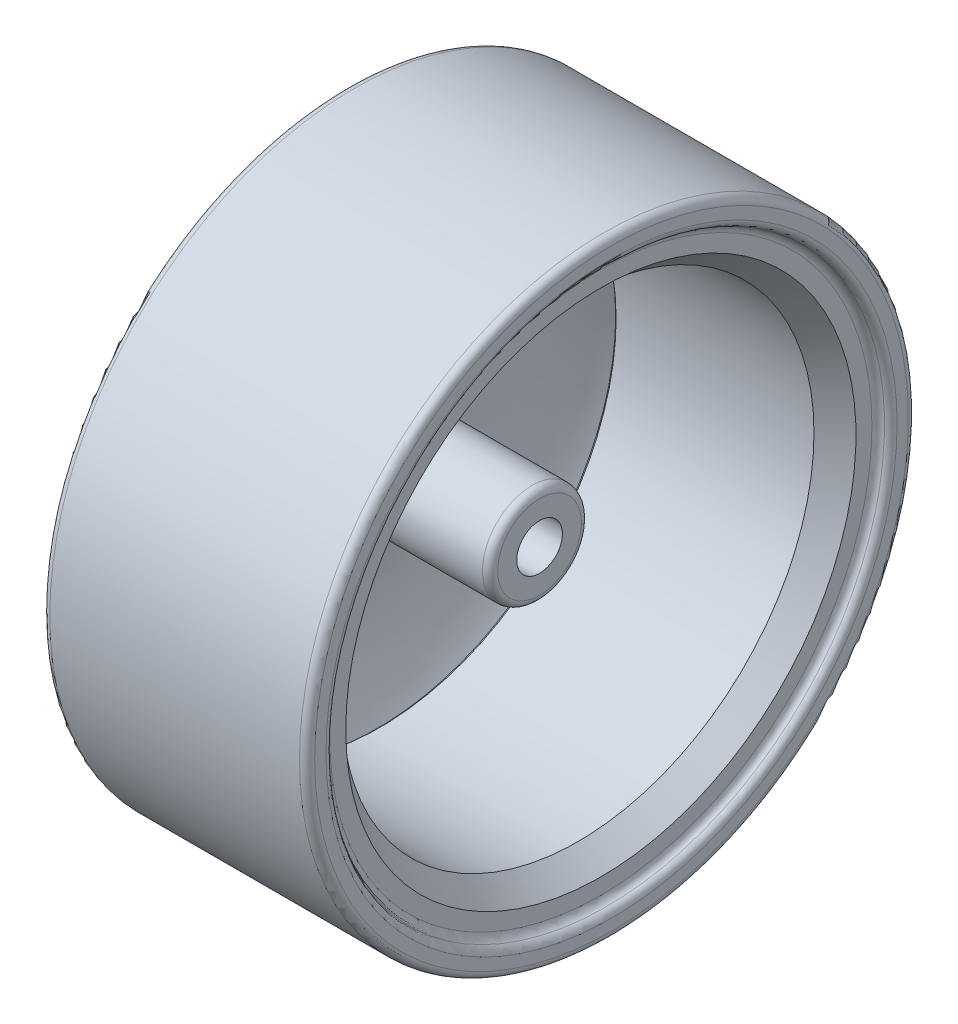
from build123d import *

# Parameters (mm, degrees)
FILLET2_R           = 0.5
FILLET3_R           = 0.5
SKETCH7_R           = 2.5
SKETCH7_R_2         = 1.5
BOSS_EXTRUDE1_DEPTH = 10
FILLET4_R           = 0.5


with BuildPart() as part:
    # Sketch1 → Revolve1 (revolve)
    with BuildSketch(Plane(origin=(0, 0, 0), x_dir=(1, 0, 0), z_dir=(0, 1, 0)), mode=Mode.PRIVATE) as revolve1_sk:
        Polygon((6.5, 15.5), (-6.5, 15.5), (-8, 16.758649447), (-8, 18.258649447), (-6.5, 18.258649447), (-5, 16.5), (5, 16.5), (6.5, 18.258649447), (8, 18.258649447), (8, 16.758649447), align=None)
    revolve(revolve1_sk.sketch.rotate(Axis((-5, 0, 0), (1, 0, 0)), 180), axis=Axis((-5, 0, 0), (1, 0, 0)))



with BuildPart() as body_2:
    # Sketch4 → Revolve2 (revolve)
    with BuildSketch(Plane(origin=(0, 0, 0), x_dir=(1, 0, 0), z_dir=(0, 1, 0)), mode=Mode.PRIVATE) as revolve2_sk:
        with BuildLine():
            Line((3.972094041, 2.5), (3.972094041, 3.25))
            Line((3.972094041, 3.25), (-7.277905959, 3.25))
            Line((-7.277905959, 3.25), (-7.277905959, 4.351093463))
            ThreePointArc((-7.277905959, 4.351093463), (-8.32292358, 10.068563098), (-6.66651706, 15.639724403))
            Line((-6.66651706, 15.639724403), (-7.241050392, 16.121815111))
            ThreePointArc((-7.241050392, 16.121815111), (-8.886649384, 10.320160105), (-8.027905959, 4.351093463))
            Line((-8.027905959, 4.351093463), (-8.027905959, 2.5))
            Line((-8.027905959, 2.5), (-6.527905959, 2.5))
            Line((-6.527905959, 2.5), (-6.527905959, 0))
            Line((-6.527905959, 0), (-5.777905959, 0))
            Line((-5.777905959, 0), (-5.777905959, 2.5))
            Line((-5.777905959, 2.5), (3.972094041, 2.5))
        make_face()
    revolve(revolve2_sk.sketch.rotate(Axis((-5, 0, 0), (1, 0, 0)), 180), axis=Axis((-5, 0, 0), (1, 0, 0)))


with BuildPart() as part_1:
    add(part.part)

    add(body_2.part)  # Revolve3 merges body 2
    # Sketch6 → Revolve3 (revolve)
    with BuildSketch(Plane.XY, mode=Mode.PRIVATE) as revolve3_sk:
        with BuildLine():
            Line((-5, 16.5), (5, 16.5))
            Line((5, 16.5), (6.5, 18.258649447))
            Line((6.5, 18.258649447), (8.2, 18.258649447))
            ThreePointArc((8.2, 18.258649447), (8.553553391, 18.405096056), (8.7, 18.758649447))
            Line((8.7, 18.758649447), (8.7, 19.5))
            ThreePointArc((8.7, 19.5), (8.553553391, 19.853553391), (8.2, 20))
            Line((8.2, 20), (-8.2, 20))
            ThreePointArc((-8.2, 20), (-8.553553391, 19.853553391), (-8.7, 19.5))
            Line((-8.7, 19.5), (-8.7, 18.758649447))
            ThreePointArc((-8.7, 18.758649447), (-8.553553391, 18.405096056), (-8.2, 18.258649447))
            Line((-8.2, 18.258649447), (-6.5, 18.258649447))
            Line((-6.5, 18.258649447), (-5, 16.5))
        make_face()
    revolve(revolve3_sk.sketch.rotate(Axis((-5, 0, 0), (1, 0, 0)), 90), axis=Axis((-5, 0, 0), (1, 0, 0)))

    # Fillet2
    fillet2_edges = [part_1.edges().sort_by_distance(p)[0] for p in [
        (-6.527905959, 0, -2.5),
        (-8.027905959, 0, -2.5),
        (-8.027905959, 0, -4.351093463),
    ]]
    fillet(fillet2_edges, radius=FILLET2_R)

    # Fillet3
    fillet3_edges = [part_1.edges().sort_by_distance(p)[0] for p in [
        (8, 0, -18.258649447),
        (-8, 0, -18.258649447),
    ]]
    fillet(fillet3_edges, radius=FILLET3_R)

    # Sketch7 → Boss-Extrude1 (add)
    with BuildSketch(Plane(origin=(3.972094041, 0, 0), x_dir=(0, 0, -1), z_dir=(1, 0, 0))):
        Circle(SKETCH7_R)
        Circle(SKETCH7_R_2, mode=Mode.SUBTRACT)
    extrude(amount=-BOSS_EXTRUDE1_DEPTH)

    # Fillet4
    fillet4_edges = [part_1.edges().sort_by_distance(p)[0] for p in [
        (3.972094041, 0, -3.25),
    ]]
    fillet(fillet4_edges, radius=FILLET4_R)


solid = part_1.part
